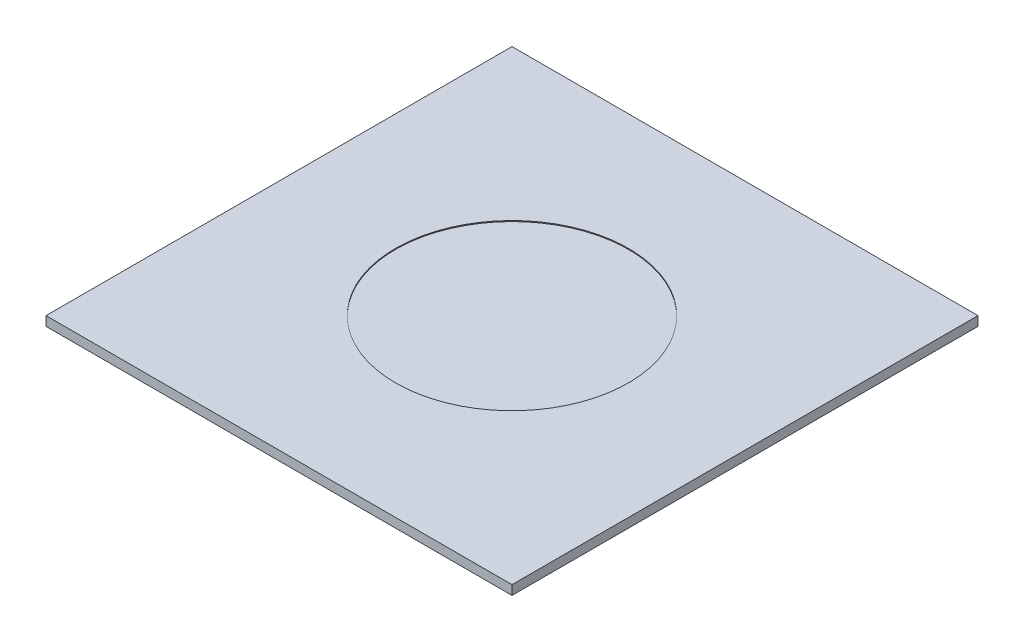
from build123d import *

# Parameters (mm, degrees)
SKETCH1_W           = 500
SKETCH1_H           = 500
BOSS_EXTRUDE1_DEPTH = 5
SKETCH2_R           = 125
CUT_EXTRUDE1_DEPTH  = 1


with BuildPart() as part:
    # Sketch1 → Boss-Extrude1 (new, symmetric)
    with BuildSketch(Plane(origin=(0, 0, 0), x_dir=(1, 0, 0), z_dir=(0, 1, 0))):
        Rectangle(SKETCH1_W, SKETCH1_H)
    extrude(amount=BOSS_EXTRUDE1_DEPTH, both=True)

    # Sketch2 → Cut-Extrude1 (cut)
    with BuildSketch(Plane(origin=(0, 5, 0), x_dir=(1, 0, 0), z_dir=(0, 1, 0))):
        with Locations(Location((0, 0, 0), (0, 0, 270))):
            Circle(SKETCH2_R)
    extrude(amount=-CUT_EXTRUDE1_DEPTH, mode=Mode.SUBTRACT)


solid = part.part
